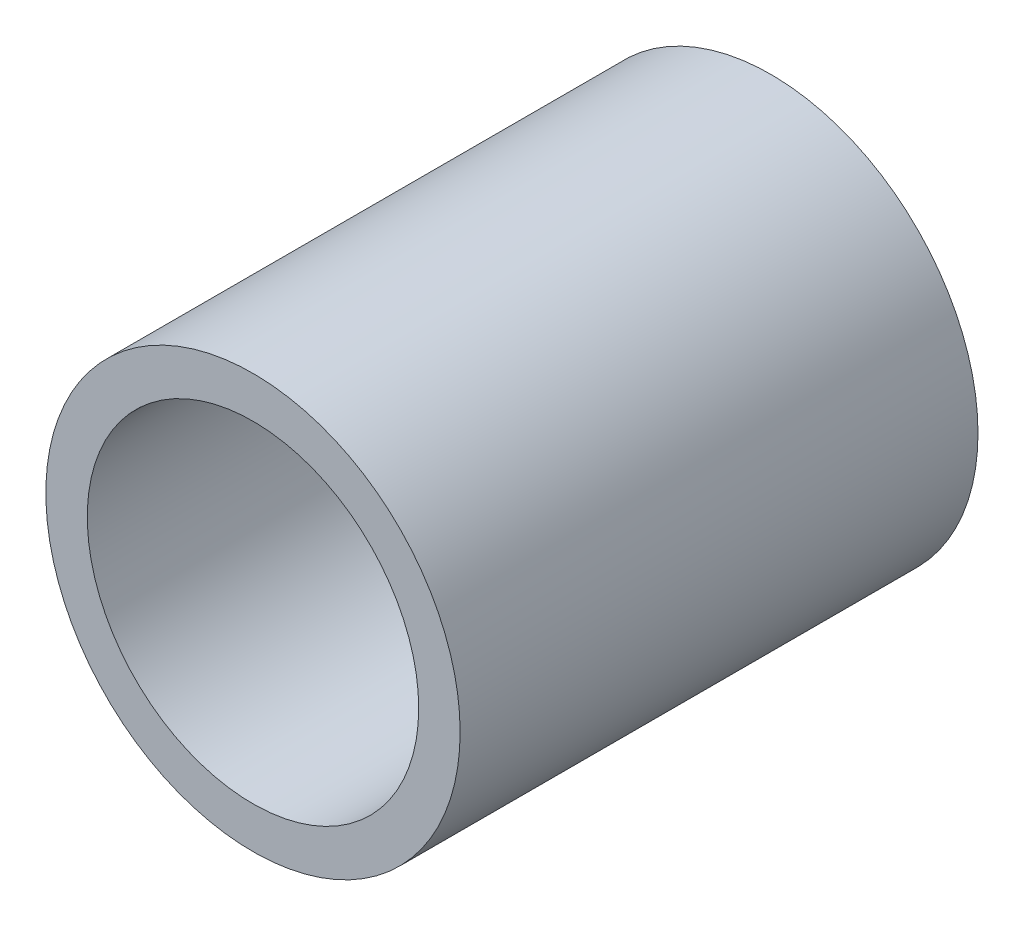
from build123d import *

# Parameters (mm, degrees)
SKETCH1_R           = 2
SKETCH1_R_2         = 1.6
BOSS_EXTRUDE1_DEPTH = 5


with BuildPart() as part:
    # Sketch1 → Boss-Extrude1 (new body)
    with BuildSketch(Plane.XY):
        Circle(SKETCH1_R)
        Circle(SKETCH1_R_2, mode=Mode.SUBTRACT)
    extrude(amount=BOSS_EXTRUDE1_DEPTH)


solid = part.part
